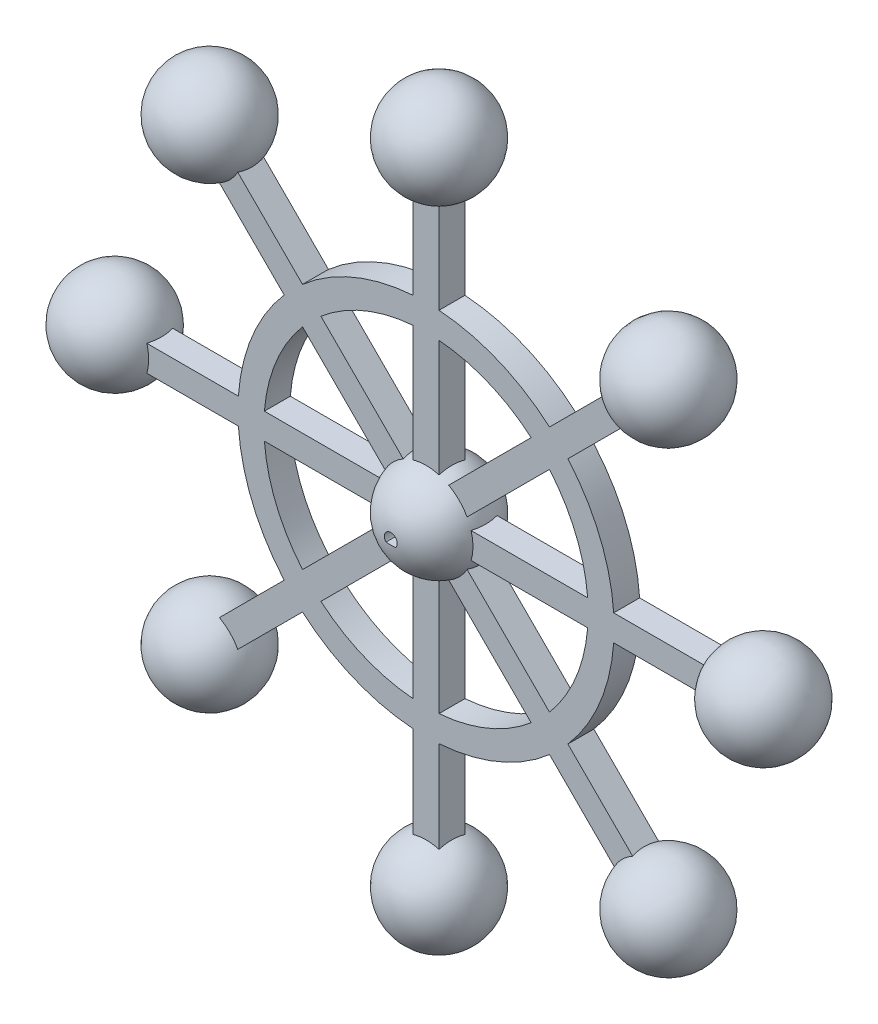
from build123d import *

# Parameters (mm, degrees)
SKETCH2_W               = 127
SKETCH2_H               = 10.16
BOSS_EXTRUDE1_DEPTH     = 5.08
CIRPATTERN1_COUNT       = 8
SKETCH5_R               = 73.66
SKETCH5_R_2             = 63.5
BOSS_EXTRUDE2_DEPTH     = 10.16
CUT_EXTRUDE1_DEPTH      = 182.218809454
CUT_EXTRUDE1_DEPTH_BACK = 182.218809454
CIRPATTERN2_COUNT       = 8


with BuildPart() as part:
    # Sketch1 → Revolve1 (revolve)
    with BuildSketch(Plane.XY):
        with BuildLine():
            Line((0, 19.05), (0, -19.05))
            ThreePointArc((0, -19.05), (19.05, 0), (0, 19.05))
        make_face()
    revolve(axis=Axis((0, 19.05, 0), (0, -1, 0)))

    # Sketch2 → Boss-Extrude1 (add, symmetric)
    with BuildSketch(Plane.XY):
        with Locations((63.5, 0)):
            Rectangle(SKETCH2_W, SKETCH2_H)
    boss_extrude1 = extrude(amount=BOSS_EXTRUDE1_DEPTH, both=True)

    # CirPattern1: Boss-Extrude1 ×8 about axis
    cirpattern1_axis = Axis((0, 0, 0), (0, 0, -1))
    for i in range(1, CIRPATTERN1_COUNT):
        add(boss_extrude1.rotate(cirpattern1_axis, i * 360 / CIRPATTERN1_COUNT))

    # Sketch5 → Boss-Extrude2 (add)
    with BuildSketch(Plane(origin=(0, 0, -5.08), x_dir=(-1, 0, 0), z_dir=(0, 0, -1))):
        Circle(SKETCH5_R)
        Circle(SKETCH5_R_2, mode=Mode.SUBTRACT)
    extrude(amount=-BOSS_EXTRUDE2_DEPTH)

    # Sketch6 → Cut-Extrude1 (cut, two sides: drawn at the far end of the back side and taken through both)
    with BuildSketch(Plane(origin=(0, 0, -5.08), x_dir=(-1, 0, 0), z_dir=(0, 0, -1)).offset(-CUT_EXTRUDE1_DEPTH_BACK)):
        with BuildLine():
            Line((-1.855488288, -1.67829283), (1.855488288, -1.67829283))
            ThreePointArc((1.855488288, -1.67829283), (0, 2.5019), (-1.855488288, -1.67829283))
        make_face()
    extrude(amount=CUT_EXTRUDE1_DEPTH + CUT_EXTRUDE1_DEPTH_BACK, mode=Mode.SUBTRACT)

    # Sketch7 → Revolve2 (revolve)
    with BuildSketch(Plane.XY):
        with BuildLine():
            Line((0, 107.95), (0, 146.05))
            ThreePointArc((0, 146.05), (19.05, 127), (0, 107.95))
        make_face()
    revolve2 = revolve(axis=Axis((0, 107.95, 0), (0, 1, 0)))

    # CirPattern2: Revolve2 ×8 about axis
    cirpattern2_axis = Axis((0, 0, 0), (0, 0, -1))
    for i in range(1, CIRPATTERN2_COUNT):
        add(revolve2.rotate(cirpattern2_axis, i * 360 / CIRPATTERN2_COUNT))


solid = part.part
